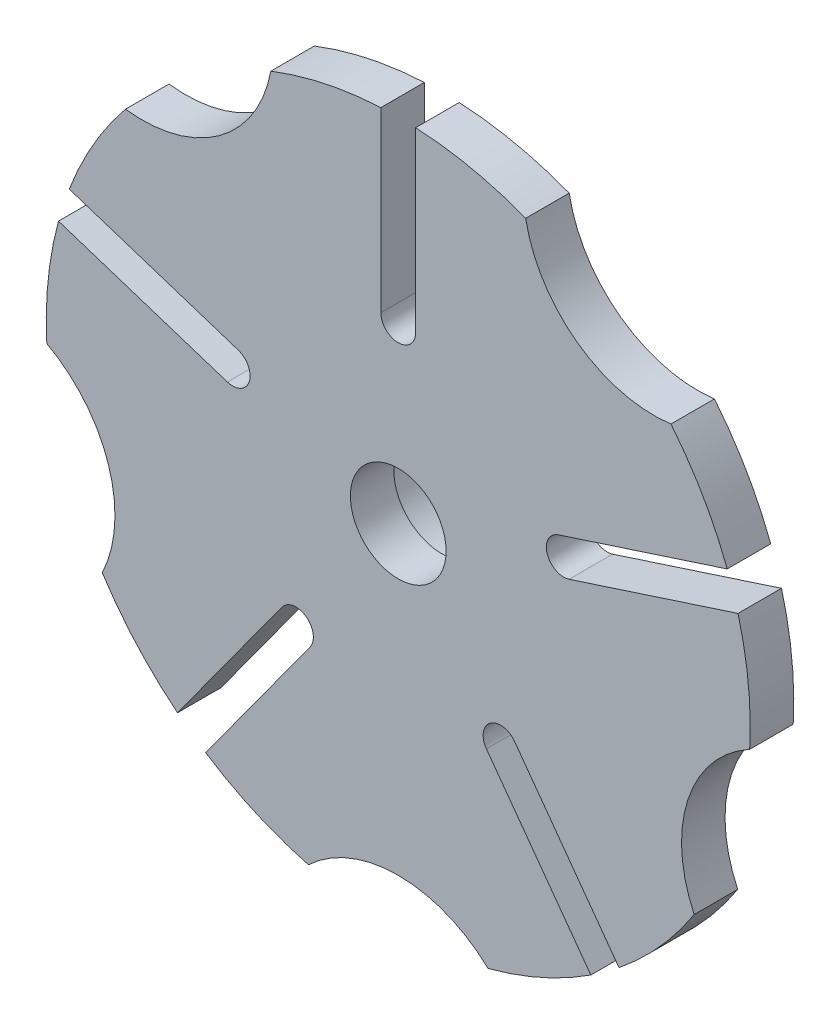
from build123d import *

# Parameters (mm, degrees)
SKETCH2_R           = 11
BOSS_EXTRUDE1_DEPTH = 10
SKETCH4_R           = 19
SKETCH4_R_2         = 15
BOSS_EXTRUDE2_DEPTH = 10


with BuildPart() as part:
    # Sketch2 → Boss-Extrude1 (new body)
    with BuildSketch(Plane.XY):
        with BuildLine():
            Line((26.747478069, -30.009538766), (50.730734825, -63.019659758))
            ThreePointArc((50.730734825, -63.019659758), (60.147924382, -54.104640877), (68.019750294, -43.79952673))
            ThreePointArc((68.019750294, -43.79952673), (66.573956141, -21.631189606), (80.773849811, -4.546444618))
            ThreePointArc((80.773849811, -4.546444618), (80.462602989, 8.417511037), (78.084053221, 21.165197956))
            Line((78.084053221, 21.165197956), (39.278328629, 8.55645371))
            ThreePointArc((39.278328629, 8.55645371), (34.238034587, 11.124611797), (36.806192674, 16.16490584))
            Line((36.806192674, 16.16490584), (75.611917266, 28.773650086))
            ThreePointArc((75.611917266, 28.773650086), (70.043302078, 40.484821919), (62.675084101, 51.155828649))
            ThreePointArc((62.675084101, 51.155828649), (41.14496766, 56.631189606), (29.284418072, 75.415567558))
            ThreePointArc((29.284418072, 75.415567558), (16.858783013, 79.125636852), (4, 80.802753492))
            Line((4, 80.802753492), (4, 40))
            ThreePointArc((4, 40), (0, 36), (-4, 40))
            Line((-4, 40), (-4, 80.802753492))
            ThreePointArc((-4, 80.802753492), (-16.858783013, 79.125636852), (-29.284418072, 75.415567558))
            ThreePointArc((-29.284418072, 75.415567558), (-41.14496766, 56.631189606), (-62.675084101, 51.155828649))
            ThreePointArc((-62.675084101, 51.155828649), (-70.043302078, 40.484821919), (-75.611917266, 28.773650086))
            Line((-75.611917266, 28.773650086), (-36.806192674, 16.16490584))
            ThreePointArc((-36.806192674, 16.16490584), (-34.238034587, 11.124611797), (-39.278328629, 8.55645371))
            Line((-39.278328629, 8.55645371), (-78.084053221, 21.165197956))
            ThreePointArc((-78.084053221, 21.165197956), (-80.462602989, 8.417511037), (-80.773849811, -4.546444618))
            ThreePointArc((-80.773849811, -4.546444618), (-66.573956141, -21.631189606), (-68.019750294, -43.79952673))
            ThreePointArc((-68.019750294, -43.79952673), (-60.147924382, -54.104640877), (-50.730734825, -63.019659758))
            Line((-50.730734825, -63.019659758), (-26.747478069, -30.009538766))
            ThreePointArc((-26.747478069, -30.009538766), (-21.160269083, -29.124611797), (-20.275342114, -34.711820784))
            Line((-20.275342114, -34.711820784), (-44.25859887, -67.721941776))
            ThreePointArc((-44.25859887, -67.721941776), (-32.869840458, -73.92332893), (-20.636566513, -78.225424859))
            ThreePointArc((-20.636566513, -78.225424859), (0, -70), (20.636566513, -78.225424859))
            ThreePointArc((20.636566513, -78.225424859), (32.869840458, -73.92332893), (44.25859887, -67.721941776))
            Line((44.25859887, -67.721941776), (20.275342114, -34.711820784))
            ThreePointArc((20.275342114, -34.711820784), (21.160269083, -29.124611797), (26.747478069, -30.009538766))
        make_face()
        Circle(SKETCH2_R, mode=Mode.SUBTRACT)
    extrude(amount=BOSS_EXTRUDE1_DEPTH)

    # Sketch4 → Boss-Extrude2 (add)
    with BuildSketch(Plane(origin=(0, 0, 0), x_dir=(-1, 0, 0), z_dir=(0, 0, -1))):
        with Locations(Location((0, 0, 0), (0, 0, 180))):
            Circle(SKETCH4_R)
        Circle(SKETCH4_R_2, mode=Mode.SUBTRACT)
    extrude(amount=BOSS_EXTRUDE2_DEPTH)


solid = part.part
